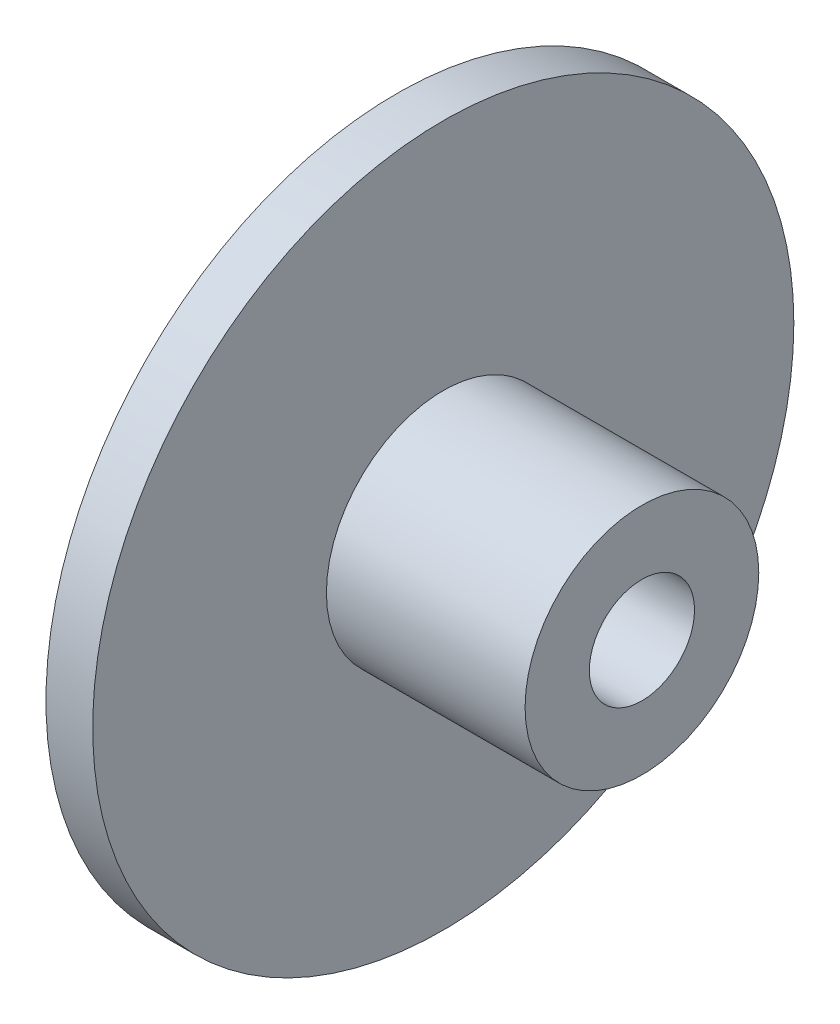
from build123d import *

# Parameters (mm, degrees)
CROQUIS1_R              = 15
CROQUIS1_R_2            = 2.25
SALIENTE_EXTRUIR1_DEPTH = 2
CROQUIS3_R              = 5
CROQUIS3_R_2            = 2.25
SALIENTE_EXTRUIR2_DEPTH = 8.5
CROQUIS4_R              = 3.75
CORTAR_EXTRUIR1_DEPTH   = 4


with BuildPart() as part:
    # Croquis1 → Saliente-Extruir1 (new body)
    with BuildSketch(Plane(origin=(0, 0, 0), x_dir=(0, 0, -1), z_dir=(1, 0, 0))):
        Circle(CROQUIS1_R)
        Circle(CROQUIS1_R_2, mode=Mode.SUBTRACT)
    extrude(amount=SALIENTE_EXTRUIR1_DEPTH)

    # Croquis3 → Saliente-Extruir2 (add)
    with BuildSketch(Plane(origin=(2, 0, 0), x_dir=(0, 0, -1), z_dir=(1, 0, 0))):
        Circle(CROQUIS3_R)
        Circle(CROQUIS3_R_2, mode=Mode.SUBTRACT)
    extrude(amount=SALIENTE_EXTRUIR2_DEPTH)

    # Croquis4 → Cortar-Extruir1 (cut)
    with BuildSketch(Plane.ZY):
        Circle(CROQUIS4_R)
    extrude(amount=-CORTAR_EXTRUIR1_DEPTH, mode=Mode.SUBTRACT)


solid = part.part
